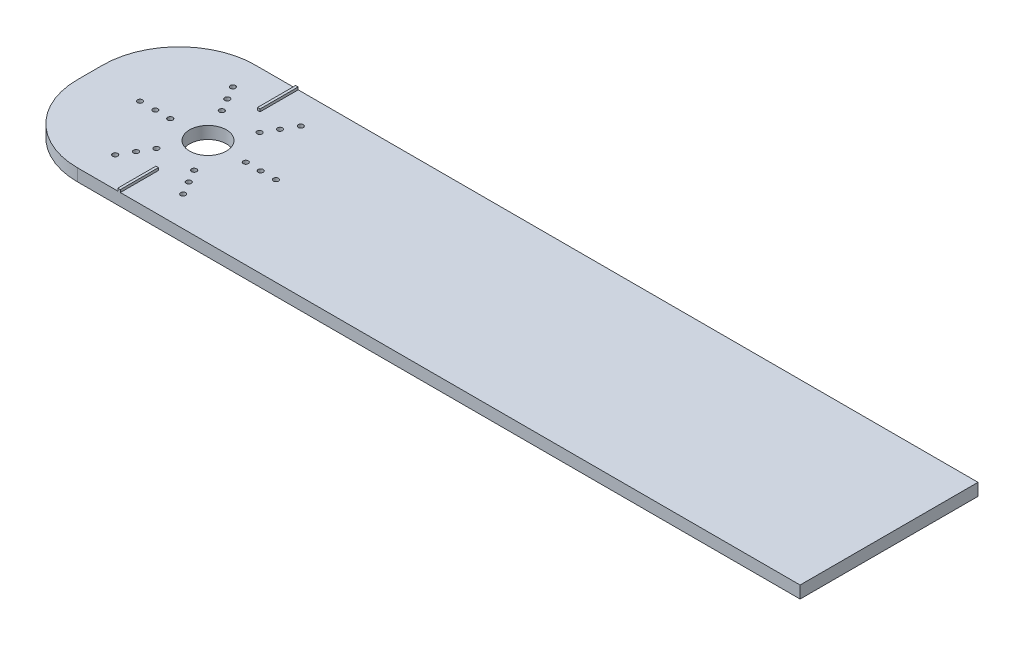
from build123d import *

# Parameters (mm, degrees)
SKETCH1_W           = 157.2
SKETCH1_H           = 35
BOSS_EXTRUDE1_DEPTH = 2.4
SKETCH2_R           = 3.625
SKETCH2_R_2         = 0.5
CUT_EXTRUDE1_DEPTH  = 2.4
SKETCH6_W           = 0.5
SKETCH6_H           = 7.5
BOSS_EXTRUDE3_DEPTH = 0.5
FILLET3_R           = 15


with BuildPart() as part:
    # Sketch1 → Boss-Extrude1 (new body)
    with BuildSketch(Plane(origin=(0, 0, 0), x_dir=(1, 0, 0), z_dir=(0, 1, 0))):
        with Locations((48.922946176, 21.495750708)):
            Rectangle(SKETCH1_W, SKETCH1_H)
    extrude(amount=BOSS_EXTRUDE1_DEPTH)

    # Sketch2 → Cut-Extrude1 (cut)
    with BuildSketch(Plane(origin=(0, 2.4, 0), x_dir=(1, 0, 0), z_dir=(0, 1, 0))):
        with Locations(Location((-6.477053824, 21.495750708, 0), (0, 0, 270))):
            Circle(SKETCH2_R)
        with Locations(Location((-13.907053824, 21.495750708, 0), (0, 0, 270))):
            Circle(SKETCH2_R_2)
        with Locations(Location((-16.842053824, 21.495750708, 0), (0, 0, 270))):
            Circle(SKETCH2_R_2)
        with Locations(Location((-19.847053824, 21.495750708, 0), (0, 0, 270))):
            Circle(SKETCH2_R_2)
        with Locations(Location((-10.192053824, 27.930319458, 0), (0, 0, 270))):
            Circle(SKETCH2_R_2)
        with Locations(Location((-11.659553824, 30.472104018, 0), (0, 0, 270))):
            Circle(SKETCH2_R_2)
        with Locations(Location((-13.162053824, 33.074510357, 0), (0, 0, 270))):
            Circle(SKETCH2_R_2)
        with Locations(Location((-2.762053824, 27.930319458, 0), (0, 0, 270))):
            Circle(SKETCH2_R_2)
        with Locations(Location((-1.294553824, 30.472104018, 0), (0, 0, 270))):
            Circle(SKETCH2_R_2)
        with Locations(Location((0.207946176, 33.074510357, 0), (0, 0, 270))):
            Circle(SKETCH2_R_2)
        with Locations(Location((0.952946176, 21.495750708, 0), (0, 0, 270))):
            Circle(SKETCH2_R_2)
        with Locations(Location((3.887946176, 21.495750708, 0), (0, 0, 270))):
            Circle(SKETCH2_R_2)
        with Locations(Location((6.892946176, 21.495750708, 0), (0, 0, 270))):
            Circle(SKETCH2_R_2)
        with Locations(Location((-2.762053824, 15.061181958, 0), (0, 0, 270))):
            Circle(SKETCH2_R_2)
        with Locations(Location((-1.294553824, 12.519397398, 0), (0, 0, 270))):
            Circle(SKETCH2_R_2)
        with Locations(Location((0.207946176, 9.91699106, 0), (0, 0, 270))):
            Circle(SKETCH2_R_2)
        with Locations(Location((-10.192053824, 15.061181958, 0), (0, 0, 270))):
            Circle(SKETCH2_R_2)
        with Locations(Location((-11.659553824, 12.519397398, 0), (0, 0, 270))):
            Circle(SKETCH2_R_2)
        with Locations(Location((-13.162053824, 9.91699106, 0), (0, 0, 270))):
            Circle(SKETCH2_R_2)
    extrude(amount=-CUT_EXTRUDE1_DEPTH, mode=Mode.SUBTRACT)

    # Sketch6 → Boss-Extrude3 (add)
    with BuildSketch(Plane(origin=(0, 2.4, 0), x_dir=(1, 0, 0), z_dir=(0, 1, 0))):
        with Locations((-6.477053824, 7.745750708)):
            Rectangle(SKETCH6_W, SKETCH6_H)
        with Locations((-6.477053824, 35.245750708)):
            Rectangle(SKETCH6_W, SKETCH6_H)
    extrude(amount=BOSS_EXTRUDE3_DEPTH)

    # Fillet3
    fillet3_edges = [part.edges().sort_by_distance(p)[0] for p in [
        (-29.677053824, 1.2, -38.995750708),
        (-29.677053824, 1.2, -3.995750708),
    ]]
    fillet(fillet3_edges, radius=FILLET3_R)


solid = part.part
